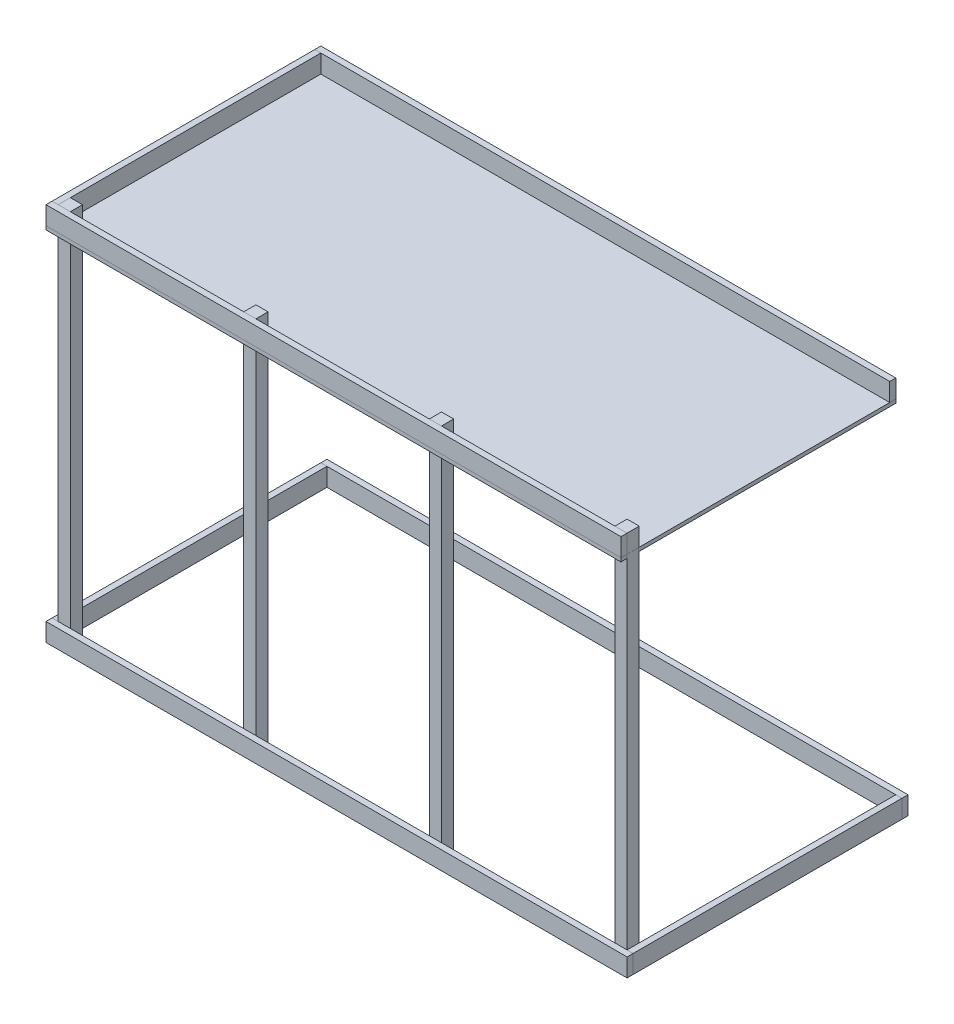
from build123d import *

# Parameters (mm, degrees)
SKETCH_1_W        = 4728
SKETCH_1_H        = 150
EXTRUDE_1_DEPTH   = 50
EXTRUDE_START     = 2210
SKETCH_1_3_W      = 4728
SKETCH_1_3_H      = 150
EXTRUDE_2_DEPTH   = 50
SKETCH_2_W        = 100
SKETCH_2_H        = 100
EXTRUDE_3_DEPTH   = 3118
EXTRUDE_3_2_DEPTH = 3118
EXTRUDE_3_3_DEPTH = 3118
EXTRUDE_3_4_DEPTH = 3118
SKETCH_3_W        = 4778
SKETCH_3_H        = 150
EXTRUDE_4_DEPTH   = 50
SKETCH_4_W        = 2210
SKETCH_4_H        = 150
EXTRUDE_5_DEPTH   = 50
SKETCH_4_W_2      = 2160
EXTRUDE_5_2_DEPTH = 50
SKETCH_5_W        = 4778
SKETCH_5_H        = 150
EXTRUDE_6_DEPTH   = 50
SKETCH_6_W        = 2210
SKETCH_6_H        = 150
EXTRUDE_7_DEPTH   = 50
SKETCH_7_W        = 4728
SKETCH_7_H        = 2260
EXTRUDE_8_DEPTH   = 30


with BuildPart() as part:
    # Эскиз1 → Бобышка-Вытянуть1 (new body)
    with BuildSketch(Plane.XY):
        with Locations((-5763, 125)):
            Rectangle(SKETCH_1_W, SKETCH_1_H)
    extrude(amount=EXTRUDE_1_DEPTH)


with BuildPart() as body_2:
    # Эскиз1<3> → Бобышка-Вытянуть2 (new body)
    with BuildSketch(Plane.XY.offset(EXTRUDE_START)):
        with Locations((-5763, 125)):
            Rectangle(SKETCH_1_3_W, SKETCH_1_3_H)
    extrude(amount=EXTRUDE_2_DEPTH)


with BuildPart() as body_3:
    # Эскиз2 → Бобышка-Вытянуть3 (new body)
    with BuildSketch(Plane(origin=(0, 200, 0), x_dir=(1, 0, 0), z_dir=(0, 1, 0))):
        with Locations((-3449, -2160)):
            Rectangle(SKETCH_2_W, SKETCH_2_H)
    extrude(amount=-EXTRUDE_3_DEPTH)


with BuildPart() as body_4:
    # Эскиз2 → Extrude 3 2 (new body)
    with BuildSketch(Plane(origin=(0, 200, 0), x_dir=(1, 0, 0), z_dir=(0, 1, 0))):
        with Locations((-8027, -2160)):
            Rectangle(SKETCH_2_W, SKETCH_2_H)
    extrude(amount=-EXTRUDE_3_2_DEPTH)


with BuildPart() as body_5:
    # Эскиз2 → Extrude 3 3 (new body)
    with BuildSketch(Plane(origin=(0, 200, 0), x_dir=(1, 0, 0), z_dir=(0, 1, 0))):
        with Locations((-6501, -2160)):
            Rectangle(SKETCH_2_W, SKETCH_2_H)
    extrude(amount=-EXTRUDE_3_3_DEPTH)


with BuildPart() as body_6:
    # Эскиз2 → Extrude 3 4 (new body)
    with BuildSketch(Plane(origin=(0, 200, 0), x_dir=(1, 0, 0), z_dir=(0, 1, 0))):
        with Locations((-4975, -2160)):
            Rectangle(SKETCH_2_W, SKETCH_2_H)
    extrude(amount=-EXTRUDE_3_4_DEPTH)


with BuildPart() as body_7:
    # Эскиз3 → Бобышка-Вытянуть4 (new body)
    with BuildSketch(Plane.XY.offset(2210)):
        with Locations((-5738, -2843)):
            Rectangle(SKETCH_3_W, SKETCH_3_H)
    extrude(amount=EXTRUDE_4_DEPTH)


with BuildPart() as body_8:
    # Эскиз4 → Бобышка-Вытянуть5 (new body)
    with BuildSketch(Plane.ZY.offset(8127)):
        with Locations((1105, -2843)):
            Rectangle(SKETCH_4_W, SKETCH_4_H)
    extrude(amount=-EXTRUDE_5_DEPTH)


with BuildPart() as body_9:
    # Эскиз4 → Extrude 5 2 (new body)
    with BuildSketch(Plane.ZY.offset(8127)):
        with Locations((1130, 125)):
            Rectangle(SKETCH_4_W_2, SKETCH_4_H)
    extrude(amount=-EXTRUDE_5_2_DEPTH)


with BuildPart() as body_10:
    # Эскиз5 → Бобышка-Вытянуть6 (new body)
    with BuildSketch(Plane(origin=(0, 0, 0), x_dir=(-1, 0, 0), z_dir=(0, 0, -1))):
        with Locations((5738, -2843)):
            Rectangle(SKETCH_5_W, SKETCH_5_H)
    extrude(amount=EXTRUDE_6_DEPTH)


with BuildPart() as body_11:
    # Эскиз6 → Бобышка-Вытянуть7 (new body)
    with BuildSketch(Plane(origin=(-3399, 0, 0), x_dir=(0, 0, -1), z_dir=(1, 0, 0))):
        with Locations((-1105, -2843)):
            Rectangle(SKETCH_6_W, SKETCH_6_H)
    extrude(amount=EXTRUDE_7_DEPTH)


with BuildPart() as body_12:
    # Эскиз7 → Бобышка-Вытянуть8 (new body)
    with BuildSketch(Plane.XZ.offset(-50)):
        with Locations((-5763, 1130)):
            Rectangle(SKETCH_7_W, SKETCH_7_H)
    extrude(amount=EXTRUDE_8_DEPTH)


solid = Compound([part.part, body_2.part, body_3.part, body_4.part, body_5.part, body_6.part, body_7.part, body_8.part, body_9.part, body_10.part, body_11.part, body_12.part])
